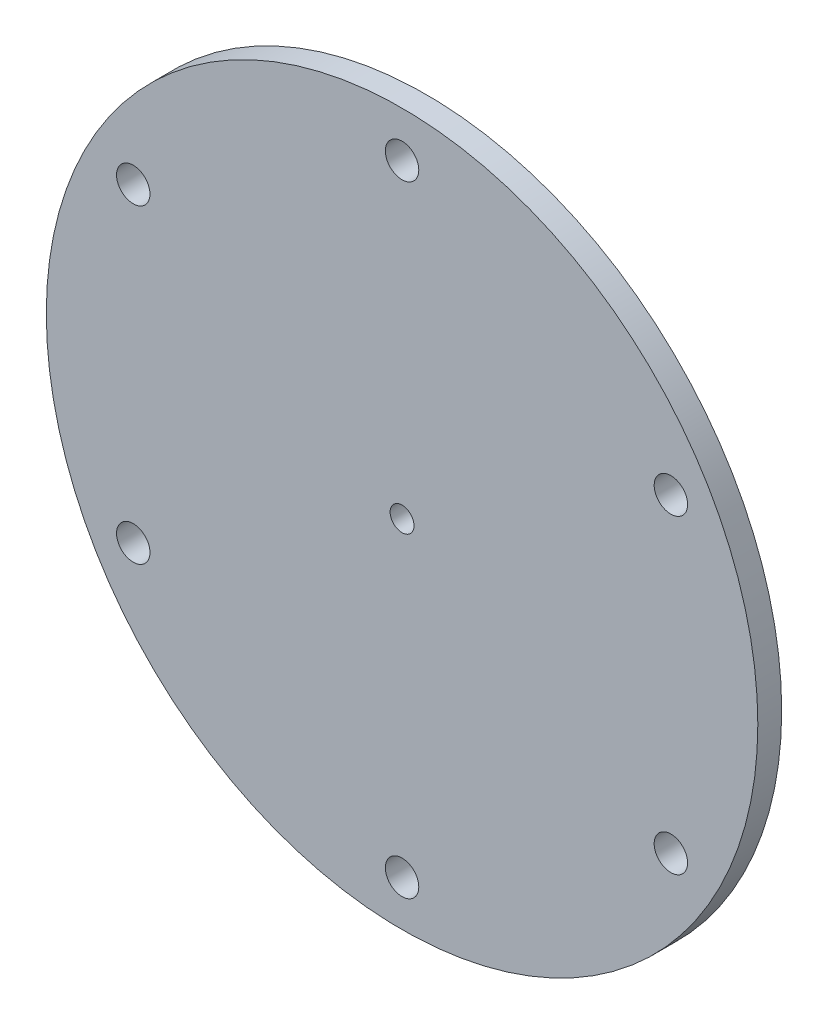
from build123d import *

# Parameters (mm, degrees)
SKETCH_1_R               = 44.7
EXTRUDE_1_DEPTH          = 3
SKETCH_1_5_R             = 1.5
CUT_EXTRUDE_1_DEPTH      = 73.5
SKETCH_1_6_R             = 2.1
CUT_EXTRUDE_2_DEPTH      = 42
PATTERN_CIRCULAR_1_COUNT = 6


with BuildPart() as part:
    # Эскиз1 → Бобышка-Вытянуть1 (new body)
    with BuildSketch(Plane.XY):
        Circle(SKETCH_1_R)
    extrude(amount=EXTRUDE_1_DEPTH)

    # Эскиз1<5> → Вырез-Вытянуть1 (cut)
    with BuildSketch(Plane.XY):
        Circle(SKETCH_1_5_R)
    extrude(amount=CUT_EXTRUDE_1_DEPTH, mode=Mode.SUBTRACT)

    # Эскиз1<6> → Вырез-Вытянуть2 (cut)
    with BuildSketch(Plane.XY):
        with Locations((0, 39)):
            Circle(SKETCH_1_6_R)
    cut_extrude_2 = extrude(amount=CUT_EXTRUDE_2_DEPTH, mode=Mode.SUBTRACT)

    # Круговой массив1: Вырез-Вытянуть2 ×6 about axis
    pattern_circular_1_axis = Axis((0, 0, 3), (0, 0, -1))
    for i in range(1, PATTERN_CIRCULAR_1_COUNT):
        add(cut_extrude_2.rotate(pattern_circular_1_axis, i * 360 / PATTERN_CIRCULAR_1_COUNT), mode=Mode.SUBTRACT)


solid = part.part
